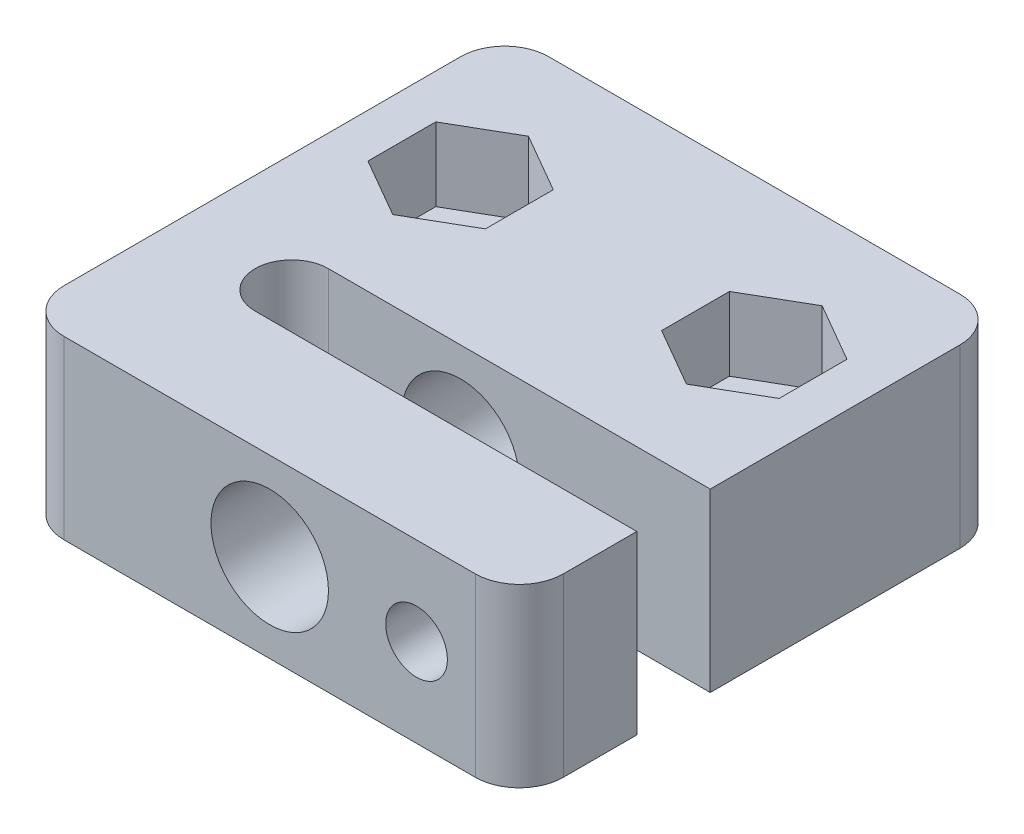
from build123d import *

# Parameters (mm, degrees)
SKETCH1_W                      = 34
SKETCH1_H                      = 33
BOSS_EXTRUDE1_DEPTH            = 12
CUT_EXTRUDE1_DEPTH             = 27.55654345
CUT_EXTRUDE2_DEPTH             = 5
F_8_0_8_DIAMETER_HOLE1_D       = 8
F_4_2_4_2_DIAMETER_HOLE1_D     = 4.2
F_4_2_4_2_DIAMETER_HOLE1_DEPTH = 8
HOLE1_D                        = 5.1
HOLE1_DEPTH                    = 12
HOLE1_CBORE_D                  = 9
HOLE1_CBORE_DEPTH              = 2
HOLE1_TIP                      = 1.532194579
FILLET1_R                      = 3


with BuildPart() as part:
    # Sketch1 → Boss-Extrude1 (new body)
    with BuildSketch(Plane(origin=(0, 0, 0), x_dir=(1, 0, 0), z_dir=(0, 1, 0))):
        Rectangle(SKETCH1_W, SKETCH1_H)
    extrude(amount=BOSS_EXTRUDE1_DEPTH)

    # Sketch2 → Cut-Extrude1 (cut, through all)
    with BuildSketch(Plane.XZ):
        with BuildLine():
            Line((17, 8.5), (-9, 8.5))
            ThreePointArc((-9, 8.5), (-11.5, 6), (-9, 3.5))
            Line((-9, 3.5), (17, 3.5))
            Line((17, 3.5), (17, 8.5))
        make_face()
    extrude(amount=-CUT_EXTRUDE1_DEPTH, mode=Mode.SUBTRACT)

    # Sketch3 → Cut-Extrude2 (cut)
    with BuildSketch(Plane(origin=(0, 12, 0), x_dir=(1, 0, 0), z_dir=(0, 1, 0))):
        Polygon((-10, 1.88), (-5.998962635, 4.19), (-5.998962635, 8.81), (-10, 11.12), (-14.001037365, 8.81), (-14.001037365, 4.19), align=None)
        Polygon((14.001037365, 4.19), (10, 1.88), (5.998962635, 4.19), (5.998962635, 8.81), (10, 11.12), (14.001037365, 8.81), align=None)
    extrude(amount=-CUT_EXTRUDE2_DEPTH, mode=Mode.SUBTRACT)

    # Ø8.0 (8) Diameter Hole1 (through all)
    with Locations(Plane.XY.offset(16.5)):
        with Locations((0, 6)):
            Hole(F_8_0_8_DIAMETER_HOLE1_D / 2)

    # Ø4.2 (4.2) Diameter Hole1
    with Locations(Plane.XY.offset(16.5)):
        with Locations((10, 6)):
            Hole(F_4_2_4_2_DIAMETER_HOLE1_D / 2, depth=F_4_2_4_2_DIAMETER_HOLE1_DEPTH)

    # Hole1
    with Locations(Plane(origin=(-10, 0, -6.5), x_dir=(0, 0, -1), z_dir=(0, -1, 0))):
        with Locations((0, 0), (0, 20)):
            CounterBoreHole(HOLE1_D / 2, HOLE1_CBORE_D / 2, HOLE1_CBORE_DEPTH, depth=HOLE1_DEPTH)
            with Locations((0, 0, -(HOLE1_DEPTH + HOLE1_TIP / 2))):  # 118° drill point
                Cone(0, HOLE1_D / 2, HOLE1_TIP, mode=Mode.SUBTRACT)

    # Fillet1
    fillet1_edges = [part.edges().sort_by_distance(p)[0] for p in [
        (17, 6, 16.5),
        (-17, 6, 16.5),
        (-17, 6, -16.5),
        (17, 6, -16.5),
    ]]
    fillet(fillet1_edges, radius=FILLET1_R)


solid = part.part
